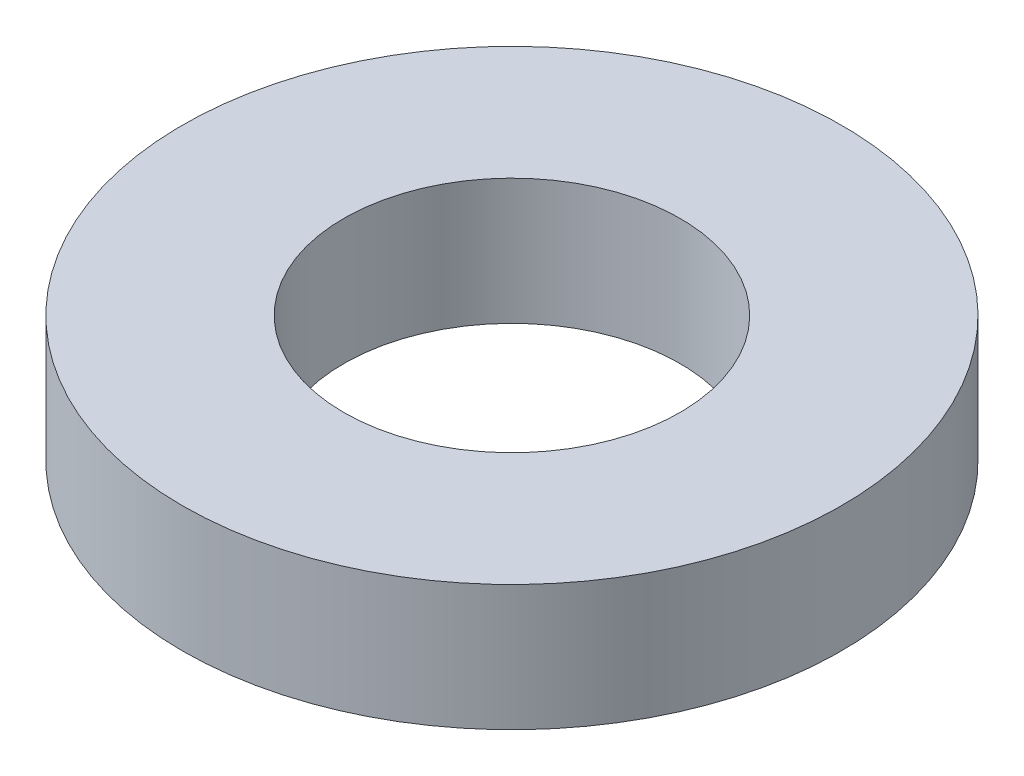
from build123d import *

# Parameters (mm, degrees)
SKETCH1_R           = 4.9
SKETCH1_R_2         = 2.5
BOSS_EXTRUDE1_DEPTH = 1.87


with BuildPart() as part:
    # Sketch1 → Boss-Extrude1 (new body)
    with BuildSketch(Plane(origin=(0, 0, 0), x_dir=(1, 0, 0), z_dir=(0, 1, 0))):
        with Locations(Location((0, 0, 0), (0, 0, 270))):
            Circle(SKETCH1_R)
        with Locations(Location((0, 0, 0), (0, 0, 270))):
            Circle(SKETCH1_R_2, mode=Mode.SUBTRACT)
    extrude(amount=BOSS_EXTRUDE1_DEPTH)


solid = part.part
